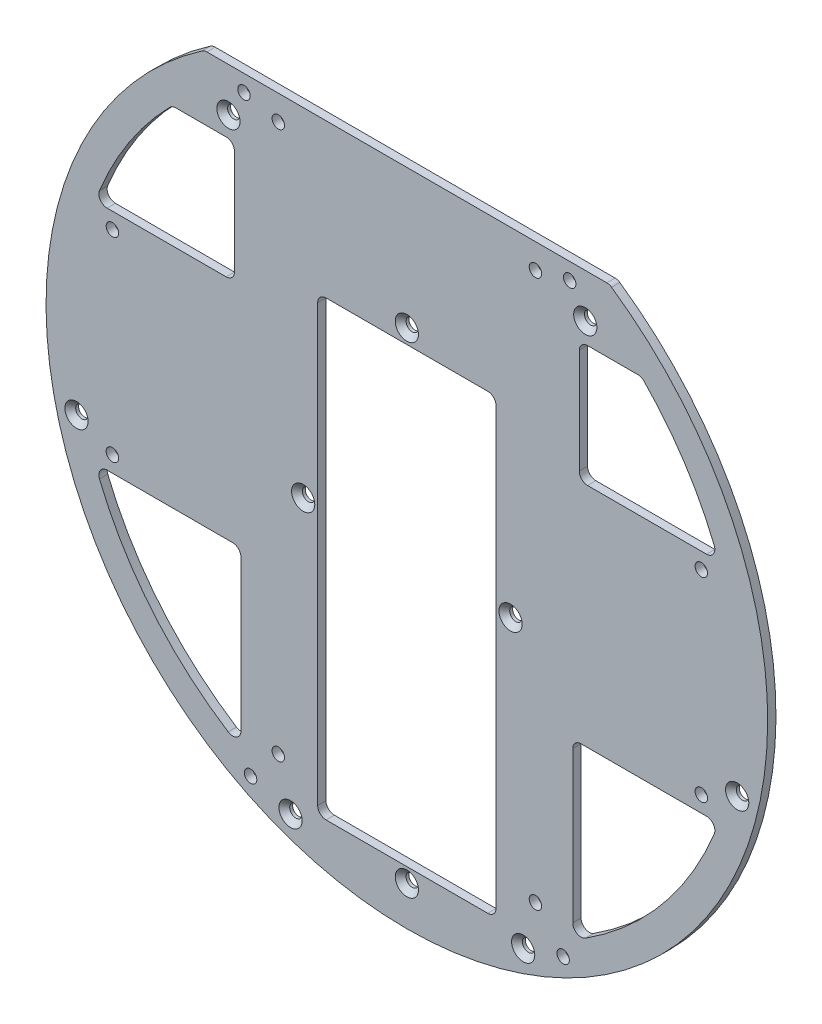
from build123d import *

# Parameters (mm, degrees)
SKETCH1_R                     = 1.5
BOSS_EXTRUDE1_DEPTH           = 2
M3_CLEARANCE_HOLE1_D          = 3
M3_CLEARANCE_HOLE1_DEPTH      = 2
M3_CLEARANCE_HOLE1_TIP        = 0.901290929
BOSS_EXTRUDE2_START           = -2
SKETCH5_R                     = 1.6
BOSS_EXTRUDE2_DEPTH           = 2
CUT_EXTRUDE1_DEPTH            = 2
CUT_EXTRUDE2_START            = -10
SKETCH8_R                     = 96.999999979
SKETCH8_R_2                   = 86.999999979
CUT_EXTRUDE2_DEPTH            = 10
SKETCH10_W                    = 43
SKETCH10_H                    = 109
CUT_EXTRUDE3_DEPTH            = 10
CSK_FOR_M3_SFHCS1_D           = 3
CSK_FOR_M3_SFHCS1_DEPTH       = 9.5
CSK_FOR_M3_SFHCS1_CSINK_D     = 5.6
CSK_FOR_M3_SFHCS1_CSINK_ANGLE = 90
CSK_FOR_M3_SFHCS1_TIP         = 0.901290929
F_3_0_3_DIAMETER_HOLE1_D      = 3
F_3_0_3_DIAMETER_HOLE1_DEPTH  = 3
F_3_0_3_DIAMETER_HOLE1_TIP    = 0.901290929
FILLET1_R                     = 2


with BuildPart() as part:
    # Sketch1 → Boss-Extrude1 (new body)
    with BuildSketch(Plane(origin=(0, 0, 0), x_dir=(-1, 0, 0), z_dir=(0, 0, -1))):
        with BuildLine():
            Line((49.999999993, 72.000000003), (34.499999968, 72.000000003))
            ThreePointArc((34.499999968, 72.000000003), (33.085786407, 71.414213566), (32.49999997, 70.000000005))
            Line((32.49999997, 70.000000005), (32.49999997, 50.749999994))
            ThreePointArc((32.49999997, 50.749999994), (31.914213535, 49.335786439), (30.49999998, 48.750000004))
            Line((30.49999998, 48.750000004), (-30.50000002, 48.750000004))
            ThreePointArc((-30.50000002, 48.750000004), (-31.914213575, 49.335786439), (-32.50000001, 50.749999994))
            Line((-32.50000001, 50.749999994), (-32.50000001, 69.749999994))
            ThreePointArc((-32.50000001, 69.749999994), (-33.085786447, 71.164213555), (-34.500000007, 71.749999992))
            Line((-34.500000007, 71.749999992), (-50.000000007, 71.749999992))
            ThreePointArc((-50.000000007, 71.749999992), (-52.651650433, 70.651650422), (-53.750000002, 67.999999996))
            Line((-53.750000002, 67.999999996), (-53.750000002, 40.749999996))
            ThreePointArc((-53.750000002, 40.749999996), (-53.164213571, 39.335786449), (-51.750000024, 38.750000018))
            Line((-51.750000024, 38.750000018), (-39.000000024, 38.750000018))
            ThreePointArc((-39.000000024, 38.750000018), (-36.171572886, 37.578427137), (-35.000000005, 34.75))
            Line((-35.000000005, 34.75), (-35.000000005, -46))
            ThreePointArc((-35.000000005, -46), (-36.171572879, -48.828427121), (-38.999999999, -49.999999994))
            Line((-38.999999999, -49.999999994), (-45.09502308, -49.999999994))
            ThreePointArc((-45.09502308, -49.999999994), (-54.039294999, -55.527864046), (-53.095023084, -66.000000011))
            ThreePointArc((-53.095023084, -66.000000011), (-46.752677079, -72.686883058), (-39.048234252, -77.744680848))
            ThreePointArc((-39.048234252, -77.744680848), (2e-09, -86.999999997), (39.048234252, -77.744680848))
            ThreePointArc((39.048234252, -77.744680848), (46.752677083, -72.686883063), (53.095023084, -66.000000011))
            ThreePointArc((53.095023084, -66.000000011), (54.039295004, -55.527864051), (45.09502308, -49.999999994))
            Line((45.09502308, -49.999999994), (39.000000001, -49.999999994))
            ThreePointArc((39.000000001, -49.999999994), (36.17157288, -48.828427121), (35.000000007, -46))
            Line((35.000000007, -46), (35.000000007, 34.75))
            ThreePointArc((35.000000007, 34.75), (36.171572888, 37.578427137), (39.000000025, 38.750000018))
            Line((39.000000025, 38.750000018), (51.750000009, 38.750000018))
            ThreePointArc((51.750000009, 38.750000018), (53.164213556, 39.335786449), (53.749999988, 40.749999996))
            Line((53.749999988, 40.749999996), (53.749999988, 68.250000008))
            ThreePointArc((53.749999988, 68.250000008), (52.651650419, 70.901650434), (49.999999993, 72.000000003))
        make_face()
        with Locations((49.348831914, 65.488111827)):
            Circle(SKETCH1_R, mode=Mode.SUBTRACT)
        with Locations((-49.348831883, 65.488111827)):
            Circle(SKETCH1_R, mode=Mode.SUBTRACT)
        with Locations((28.045651768, -77.054794901)):
            Circle(SKETCH1_R, mode=Mode.SUBTRACT)
        with Locations((-28.045651737, -77.054794901)):
            Circle(SKETCH1_R, mode=Mode.SUBTRACT)
    extrude(amount=-BOSS_EXTRUDE1_DEPTH)

    # M3 Clearance Hole1
    with Locations(Plane(origin=(-39.259818305, 68, 2), x_dir=(1, 0, 0), z_dir=(0, 0, 1))):
        with Locations((0, 0), (78.51963661, 0)):
            Hole(M3_CLEARANCE_HOLE1_D / 2, depth=M3_CLEARANCE_HOLE1_DEPTH)
            with Locations((0, 0, -(M3_CLEARANCE_HOLE1_DEPTH + M3_CLEARANCE_HOLE1_TIP / 2))):  # 118° drill point
                Cone(0, M3_CLEARANCE_HOLE1_D / 2, M3_CLEARANCE_HOLE1_TIP, mode=Mode.SUBTRACT)

    # Sketch5 → Boss-Extrude2 (add)
    with BuildSketch(Plane.XY.offset(2).offset(BOSS_EXTRUDE2_START)):
        with BuildLine():
            Line((-48.836461775, 72), (48.836461775, 72))
            ThreePointArc((48.836461775, 72), (0, -86.999999993), (-48.836461775, 72))
        make_face()
        with Locations((-39.259818305, 68)):
            Circle(SKETCH5_R, mode=Mode.SUBTRACT)
        with Locations((39.259818305, 68)):
            Circle(SKETCH5_R, mode=Mode.SUBTRACT)
        with Locations((-28.045651768, -77.054794901)):
            Circle(SKETCH5_R, mode=Mode.SUBTRACT)
        with Locations((28.045651737, -77.054794901)):
            Circle(SKETCH5_R, mode=Mode.SUBTRACT)
    extrude(amount=BOSS_EXTRUDE2_DEPTH)

    # Sketch6 → Cut-Extrude1 (cut)
    with BuildSketch(Plane.XY.offset(2)):
        with BuildLine():
            Line((-75.175409678, -27.361611463), (-40.000000015, -27.361611463))
            Line((-40.000000015, -27.361611463), (-40.000000015, -69.2820323))
            ThreePointArc((-40.000000015, -69.2820323), (-61.283555465, -51.423008772), (-75.175409678, -27.361611463))
        make_face()
        with BuildLine():
            Line((41.568542512, 27.361611478), (75.175409701, 27.361611478))
            ThreePointArc((75.175409701, 27.361611478), (67.471315698, 42.983968695), (56.568542512, 56.568542531))
            Line((56.568542512, 56.568542531), (41.568542512, 56.568542531))
            Line((41.568542512, 56.568542531), (41.568542512, 27.361611478))
        make_face()
        with BuildLine():
            Line((40.000000015, -27.361611463), (40.000000015, -69.2820323))
            ThreePointArc((40.000000015, -69.2820323), (61.283555468, -51.423008776), (75.175409678, -27.361611463))
            Line((75.175409678, -27.361611463), (40.000000015, -27.361611463))
        make_face()
        with BuildLine():
            Line((-56.568542512, 56.568542531), (-41.568542512, 56.568542531))
            Line((-41.568542512, 56.568542531), (-41.568542512, 27.361611478))
            Line((-41.568542512, 27.361611478), (-75.175409701, 27.361611478))
            ThreePointArc((-75.175409701, 27.361611478), (-67.471315695, 42.983968693), (-56.568542512, 56.568542531))
        make_face()
    extrude(amount=-CUT_EXTRUDE1_DEPTH, mode=Mode.SUBTRACT)

    # Sketch8 → Cut-Extrude2 (cut)
    with BuildSketch(Plane.XY.offset(2).offset(CUT_EXTRUDE2_START)):
        Circle(SKETCH8_R)
        Circle(SKETCH8_R_2, mode=Mode.SUBTRACT)
    extrude(amount=CUT_EXTRUDE2_DEPTH, mode=Mode.SUBTRACT)

    # Sketch10 → Cut-Extrude3 (cut)
    with BuildSketch(Plane.XY.offset(2)):
        with Locations((0, -19.499999997)):
            Rectangle(SKETCH10_W, SKETCH10_H)
    extrude(amount=-CUT_EXTRUDE3_DEPTH, mode=Mode.SUBTRACT)

    # CSK for M3 SFHCS1
    with Locations(Plane(origin=(0, 38.500000003, 2), x_dir=(1, 0, 0), z_dir=(0, 0, 1))):
        with Locations((0, 0), (-25, -48), (0, -116), (-79.647661626, -58), (79.647661626, -58), (-43.018232726, 22.936403319), (-28.045651768, -115.554794904), (43.018232726, 22.936403319), (25, -48), (28.045651737, -115.554794904)):
            CounterSinkHole(CSK_FOR_M3_SFHCS1_D / 2, CSK_FOR_M3_SFHCS1_CSINK_D / 2, depth=CSK_FOR_M3_SFHCS1_DEPTH, counter_sink_angle=CSK_FOR_M3_SFHCS1_CSINK_ANGLE)
            with Locations((0, 0, -(CSK_FOR_M3_SFHCS1_DEPTH + CSK_FOR_M3_SFHCS1_TIP / 2))):  # 118° drill point
                Cone(0, CSK_FOR_M3_SFHCS1_D / 2, CSK_FOR_M3_SFHCS1_TIP, mode=Mode.SUBTRACT)

    # Ø3.0 (3) Diameter Hole1
    with Locations(Plane(origin=(-71, 23.5, 2), x_dir=(1, 0, 0), z_dir=(0, 0, 1))):
        with Locations((0, 0), (0, -47), (40, -89.5), (33.318788522, -97.453541508), (40, 42.5), (102, 42.5), (142, 0), (102, -89.5), (142, -47), (108.681211478, -97.453541508)):
            Hole(F_3_0_3_DIAMETER_HOLE1_D / 2, depth=F_3_0_3_DIAMETER_HOLE1_DEPTH)
            with Locations((0, 0, -(F_3_0_3_DIAMETER_HOLE1_DEPTH + F_3_0_3_DIAMETER_HOLE1_TIP / 2))):  # 118° drill point
                Cone(0, F_3_0_3_DIAMETER_HOLE1_D / 2, F_3_0_3_DIAMETER_HOLE1_TIP, mode=Mode.SUBTRACT)

    # Fillet1
    fillet1_edges = [part.edges().sort_by_distance(p)[0] for p in [
        (48.836461775, 72, 1),
        (-40.000000015, -69.2820323, 1),
        (-75.175409678, -27.361611463, 1),
        (-40.000000015, -27.361611463, 1),
        (41.568542512, 27.361611478, 1),
        (41.568542512, 56.568542531, 1),
        (56.568542512, 56.568542531, 1),
        (75.175409701, 27.361611478, 1),
        (40.000000015, -27.361611463, 1),
        (75.175409678, -27.361611463, 1),
        (40.000000015, -69.2820323, 1),
        (-75.175409701, 27.361611478, 1),
        (-56.568542512, 56.568542531, 1),
        (-41.568542512, 56.568542531, 1),
        (-41.568542512, 27.361611478, 1),
        (-48.836461746, 72.000000003, 1),
        (21.5, 35.000000003, 1),
        (21.5, -73.999999997, 1),
        (-21.5, -73.999999997, 1),
        (-21.5, 35.000000003, 1),
    ]]
    fillet(fillet1_edges, radius=FILLET1_R)


solid = part.part
